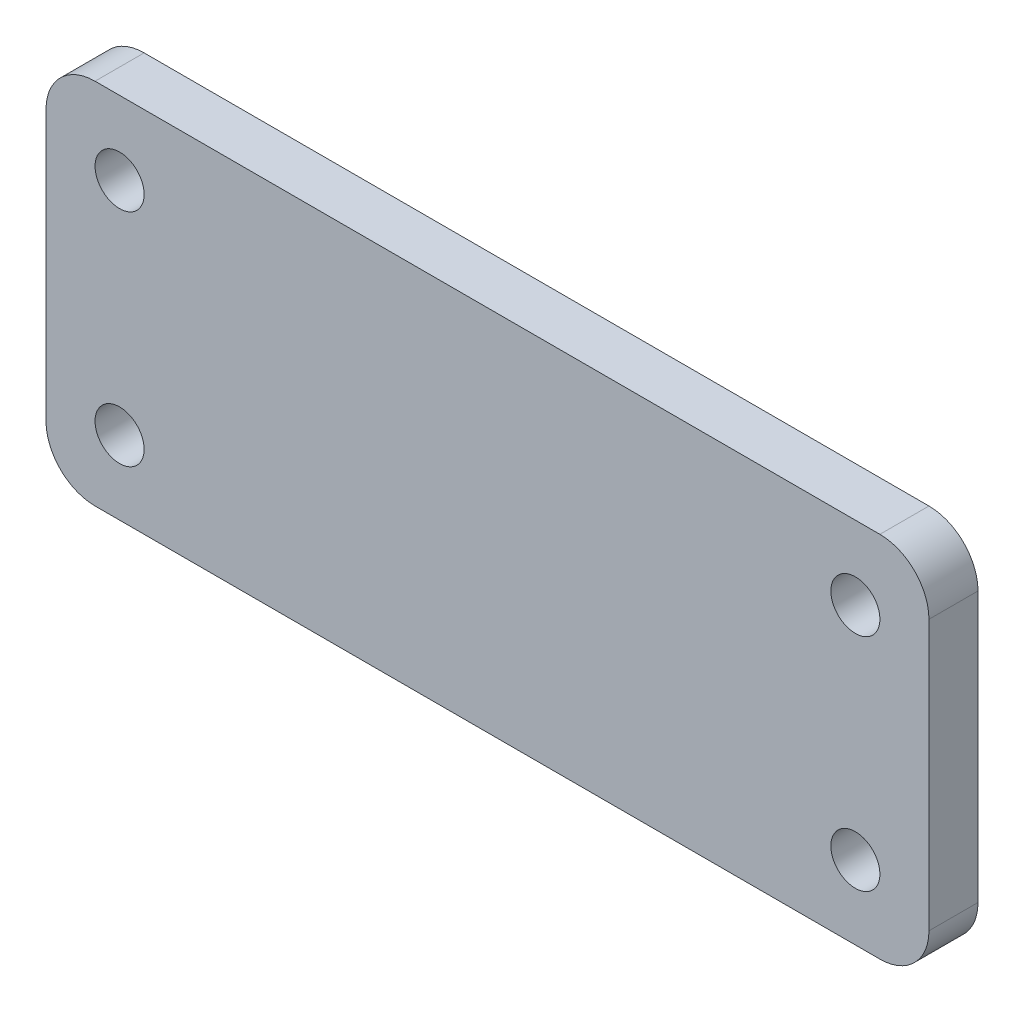
from build123d import *

# Parameters (mm, degrees)
BOSS_EXTRUDE1_DEPTH = 10
SKETCH6_R           = 5
CUT_EXTRUDE1_DEPTH  = 10
SKETCH6_4_R         = 5
CUT_EXTRUDE4_DEPTH  = 10


with BuildPart() as part:
    # Sketch2 → Boss-Extrude1 (new body)
    with BuildSketch(Plane.XY):
        with BuildLine():
            Line((10, 0), (170, 0))
            ThreePointArc((170, 0), (177.071067812, -2.928932188), (180, -10))
            Line((180, -10), (180, -65))
            ThreePointArc((180, -65), (177.071067812, -72.071067812), (170, -75))
            Line((170, -75), (10, -75))
            ThreePointArc((10, -75), (2.928932188, -72.071067812), (0, -65))
            Line((0, -65), (0, -10))
            ThreePointArc((0, -10), (2.928932188, -2.928932188), (10, 0))
        make_face()
    extrude(amount=BOSS_EXTRUDE1_DEPTH)

    # Sketch6 → Cut-Extrude1 (cut)
    with BuildSketch(Plane.XY):
        with Locations((15, -15)):
            Circle(SKETCH6_R)
    extrude(amount=CUT_EXTRUDE1_DEPTH, mode=Mode.SUBTRACT)

    # Sketch6<4> → Cut-Extrude4 (cut)
    with BuildSketch(Plane.XY):
        with Locations((165, -15)):
            Circle(SKETCH6_4_R)
        with Locations((15, -60)):
            Circle(SKETCH6_4_R)
        with Locations((165, -60)):
            Circle(SKETCH6_4_R)
    extrude(amount=CUT_EXTRUDE4_DEPTH, mode=Mode.SUBTRACT)


solid = part.part
